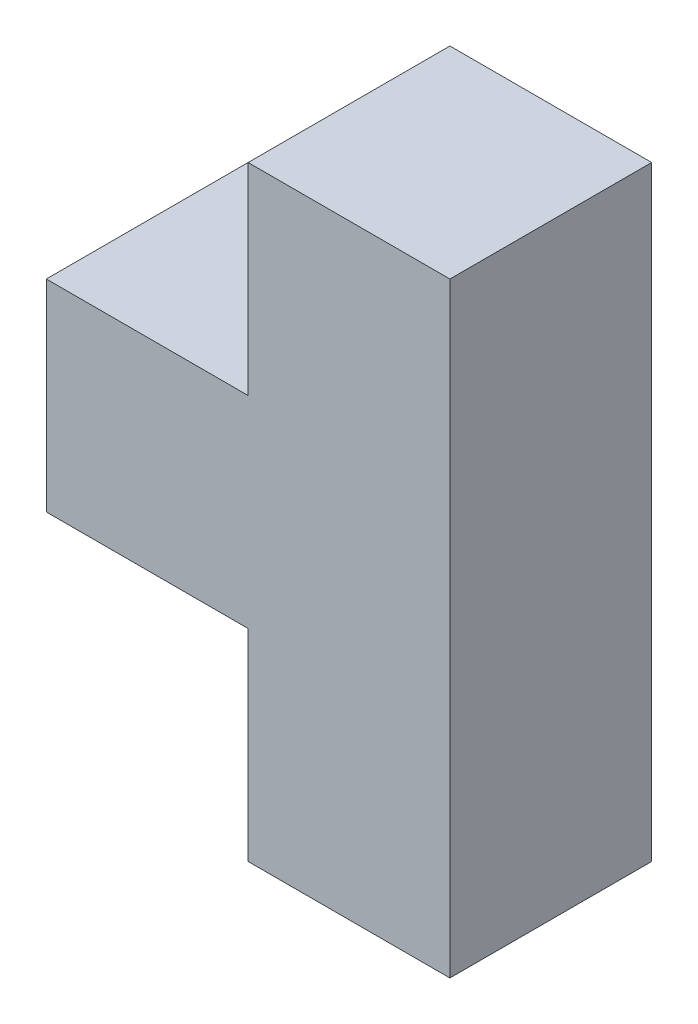
from build123d import *

# Parameters (mm, degrees)
SKETCH1_W           = 90
SKETCH1_H           = 60
BOSS_EXTRUDE1_DEPTH = 15
SKETCH2_W           = 30
SKETCH2_H           = 30
CUT_EXTRUDE1_DEPTH  = 62.846584384


with BuildPart() as part:
    # Sketch1 → Boss-Extrude1 (new, symmetric)
    with BuildSketch(Plane(origin=(0, 0, 0), x_dir=(0, 1, 0), z_dir=(0, 0, 1))):
        Rectangle(SKETCH1_W, SKETCH1_H)
    extrude(amount=BOSS_EXTRUDE1_DEPTH, both=True)

    # Sketch2 → Cut-Extrude1 (cut, through all)
    with BuildSketch(Plane.XY.offset(15)):
        with Locations((-15, -30)):
            Rectangle(SKETCH2_W, SKETCH2_H)
        with Locations((-15, 30)):
            Rectangle(SKETCH2_W, SKETCH2_H)
    extrude(amount=-CUT_EXTRUDE1_DEPTH, mode=Mode.SUBTRACT)


solid = part.part
